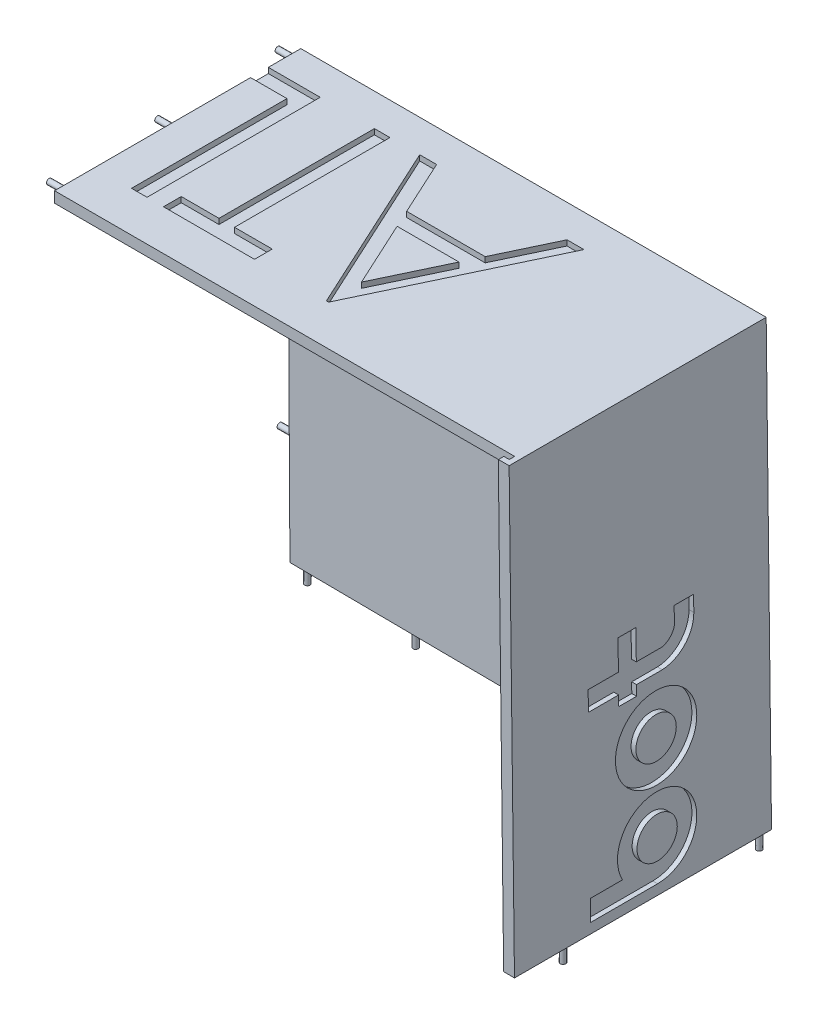
from build123d import *

# Parameters (mm, degrees)
SALIENTE_EXTRUIR1_DEPTH = 2.5
SALIENTE_EXTRUIR2_DEPTH = 45
CROQUIS17_R             = 2
CROQUIS17_R_2           = 1.5
CORTAR_EXTRUIR1_DEPTH   = 45
CROQUIS18_R             = 0.5
SALIENTE_EXTRUIR3_DEPTH = 3
CROQUIS19_W             = 84
CROQUIS19_H             = 2
CORTAR_EXTRUIR2_DEPTH   = 10
CROQUIS24_W             = 0.024080101
CROQUIS24_H             = 2
CORTAR_EXTRUIR11_DEPTH  = 2
CROQUIS30_W             = 1
CROQUIS30_H             = 1
CORTAR_EXTRUIR12_DEPTH  = 101
CROQUIS32_W             = 1
CROQUIS32_H             = 79.482316352
CORTAR_EXTRUIR13_DEPTH  = 1
CROQUIS33_W             = 1
CROQUIS33_H             = 1
CORTAR_EXTRUIR14_DEPTH  = 1
CROQUIS35_R             = 0.5
SALIENTE_EXTRUIR4_DEPTH = 3
CROQUIS37_R             = 0.5
CORTAR_EXTRUIR15_DEPTH  = 4
CROQUIS38_R             = 0.5
CORTAR_EXTRUIR16_DEPTH  = 4
CORTAR_EXTRUIR17_DEPTH  = 1
CROQUIS40_R             = 7.515901536
CROQUIS40_R_2           = 3.728280466
CROQUIS40_R_3           = 3.722695871
CORTAR_EXTRUIR19_DEPTH  = 0.9
CROQUIS41_R             = 0.5
SALIENTE_EXTRUIR5_DEPTH = 3
CROQUIS42_R             = 0.5
SALIENTE_EXTRUIR6_DEPTH = 3
CROQUIS45_R             = 0.5
CORTAR_EXTRUIR22_DEPTH  = 4
CROQUIS46_R             = 0.5
CORTAR_EXTRUIR23_DEPTH  = 4


with BuildPart() as part:
    # Croquis15 → Saliente-Extruir1 (new body)
    with BuildSketch(Plane.XY):
        Polygon((0, 80), (86, 80), (86.987170897, -1.494021214), (0.493585448, -0.747010607), align=None)
    extrude(amount=SALIENTE_EXTRUIR1_DEPTH)

    # Croquis16 → Saliente-Extruir2 (add)
    with BuildSketch(Plane.XY.offset(2.5)):
        Polygon((0, 80), (0.01204005, 78), (84.024080101, 78), (84.986811751, -1.476485582), (86.987170897, -1.494021214), (86, 80), align=None)
    extrude(amount=SALIENTE_EXTRUIR2_DEPTH)

    # Croquis17 → Cortar-Extruir1 (cut)
    with BuildSketch(Plane.XY.offset(2.5)):
        with Locations((79.072166937, 74)):
            Circle(CROQUIS17_R)
        with Locations((72.120400503, 63)):
            Circle(CROQUIS17_R_2)
    extrude(amount=-CORTAR_EXTRUIR1_DEPTH, mode=Mode.SUBTRACT)

    # Croquis18 → Saliente-Extruir3 (add)
    with BuildSketch(Plane(origin=(-0.006414337, -0.742692308, 0), x_dir=(0.9999627066458414, -0.008636279148040384, 0), z_dir=(-0.008636279148040384, -0.9999627066458414, 0))):
        with Locations(Location((2.500018433, 1.25, 0), (0, 0, 180))):
            Circle(CROQUIS18_R)
        with Locations(Location((85.996829638, 1.25, 0), (0, 0, 180))):
            Circle(CROQUIS18_R)
        with Locations(Location((22.500018433, 1.25, 0), (0, 0, 180))):
            Circle(CROQUIS18_R)
        with Locations(Location((65.996829638, 1.25, 0), (0, 0, 180))):
            Circle(CROQUIS18_R)
        with Locations(Location((43.496829638, 1.25, 0), (0, 0, 180))):
            Circle(CROQUIS18_R)
    extrude(amount=SALIENTE_EXTRUIR3_DEPTH)

    # Croquis19 → Cortar-Extruir2 (cut)
    with BuildSketch(Plane(origin=(0, 80, 0), x_dir=(1, 0, 0), z_dir=(0, 1, 0))):
        with Locations((42, -46.5)):
            Rectangle(CROQUIS19_W, CROQUIS19_H)
    extrude(amount=-CORTAR_EXTRUIR2_DEPTH, mode=Mode.SUBTRACT)

    # Croquis24 → Cortar-Extruir11 (cut)
    with BuildSketch(Plane.XY.offset(47.5)):
        with Locations((84.012040051, 79)):
            Rectangle(CROQUIS24_W, CROQUIS24_H)
    extrude(amount=-CORTAR_EXTRUIR11_DEPTH, mode=Mode.SUBTRACT)

    # Croquis30 → Cortar-Extruir12 (cut)
    with BuildSketch(Plane(origin=(0, 80, 0), x_dir=(1, 0, 0), z_dir=(0, 1, 0))):
        with Locations((84.524080101, -46)):
            Rectangle(CROQUIS30_W, CROQUIS30_H)
    extrude(amount=-CORTAR_EXTRUIR12_DEPTH, mode=Mode.SUBTRACT)

    # Croquis32 → Cortar-Extruir13 (cut)
    with BuildSketch(Plane(origin=(84.956460397, 1.029112859, 0), x_dir=(0, 0, 1), z_dir=(-0.9999266406620362, -0.01211252633991657, 0))):
        with Locations((46, 37.235375912)):
            Rectangle(CROQUIS32_W, CROQUIS32_H)
    extrude(amount=-CORTAR_EXTRUIR13_DEPTH, mode=Mode.SUBTRACT)

    # Croquis33 → Cortar-Extruir14 (cut)
    with BuildSketch(Plane(origin=(-0.006411756, -0.731414451, 0), x_dir=(0.9999615787185102, -0.008765904789859459, 0), z_dir=(-0.008765904789859457, -0.9999615787185101, 0))):
        with Locations((85.496489181, 46)):
            Rectangle(CROQUIS33_W, CROQUIS33_H)
    extrude(amount=-CORTAR_EXTRUIR14_DEPTH, mode=Mode.SUBTRACT)

    # Croquis35 → Saliente-Extruir4 (add)
    with BuildSketch(Plane(origin=(-0.006411756, -0.731414451, 0), x_dir=(0.9999615787185102, -0.008765904789859459, 0), z_dir=(-0.008765904789859457, -0.9999615787185101, 0))):
        with Locations(Location((85.996707183, 37.5, 0), (0, 0, 180))):
            Circle(CROQUIS35_R)
    extrude(amount=SALIENTE_EXTRUIR4_DEPTH)

    # Croquis37 → Cortar-Extruir15 (cut)
    with BuildSketch(Plane(origin=(-0.006411756, -0.731414451, 0), x_dir=(0.9999615787185102, -0.008765904789859459, 0), z_dir=(-0.008765904789859457, -0.9999615787185101, 0))):
        with Locations((85.996925186, 9.5)):
            Circle(CROQUIS37_R)
    extrude(amount=-CORTAR_EXTRUIR15_DEPTH, mode=Mode.SUBTRACT)

    # Croquis38 → Cortar-Extruir16 (cut)
    with BuildSketch(Plane(origin=(-0.006414337, -0.742692308, 0), x_dir=(0.9999627066458414, -0.008636279148040382, 0), z_dir=(-0.008636279148040382, -0.9999627066458414, 0))):
        with Locations((12.500018433, 1.25)):
            Circle(CROQUIS38_R)
        with Locations((32.500018433, 1.25)):
            Circle(CROQUIS38_R)
        with Locations((55.000018433, 1.25)):
            Circle(CROQUIS38_R)
        with Locations((77.000018433, 1.25)):
            Circle(CROQUIS38_R)
    extrude(amount=-CORTAR_EXTRUIR16_DEPTH, mode=Mode.SUBTRACT)

    # Croquis39 → Cortar-Extruir17 (cut)
    # profile 1 of 3: a face of its own
    with BuildSketch(Plane(origin=(0, 80, 0), x_dir=(1, 0, 0), z_dir=(0, 1, 0))):
        Polygon((42.740086015, -38), (27.970855246, -6), (31.092650117, -6), (35.823419348, -16.256410256), (50.329829605, -16.256410256), (55.19521422, -6), (58.329829605, -6), (43.150342425, -38), align=None)
        Polygon((42.977265502, -31.762820513), (48.772137297, -19.538461538), (37.336239861, -19.538461538), align=None, mode=Mode.SUBTRACT)
    # profile 2 of 3: a face of its own
    with BuildSketch(Plane(origin=(0, 80, 0), x_dir=(1, 0, 0), z_dir=(0, 1, 0))):
        Polygon((29.447778323, -34.717948718), (29.447778323, -38), (12.627265502, -38), (12.627265502, -34.717948718), (19.601624476, -34.717948718), (19.601624476, -6), (22.473419348, -6), (22.473419348, -34.717948718), align=None)
    # profile 3 of 3: a face of its own
    with BuildSketch(Plane(origin=(0, 80, 0), x_dir=(1, 0, 0), z_dir=(0, 1, 0))):
        Polygon((9.591368066, -38), (6.719573194, -38), (6.719573194, -9.282051282), (-5.588119113, -9.282051282), (-5.588119113, -6), (9.591368066, -6), align=None)
    extrude(amount=-CORTAR_EXTRUIR17_DEPTH, mode=Mode.SUBTRACT)

    # Croquis40 → Cortar-Extruir19 (cut)
    # profile 1 of 3: a face of its own
    with BuildSketch(Plane(origin=(86.956313679, 1.053337912, 0), x_dir=(0, 0, -1), z_dir=(0.9999266406620362, 0.012112526339916658, 0))):
        with Locations(Location((-21.026467212, 22.472656931, 0), (0, 0, 90))):
            Circle(CROQUIS40_R)
        with Locations(Location((-21.026467212, 22.472656931, 0), (0, 0, 90))):
            Circle(CROQUIS40_R_2, mode=Mode.SUBTRACT)
    # profile 2 of 3: a face of its own
    with BuildSketch(Plane(origin=(86.956313679, 1.053337912, 0), x_dir=(0, 0, -1), z_dir=(0.9999266406620362, 0.012112526339916658, 0))):
        with BuildLine():
            Line((-21.026467212, -0.713555766), (-33.411935882, -0.713555766))
            Line((-33.411935882, -0.713555766), (-33.411935882, 3.110384386))
            Line((-33.411935882, 3.110384386), (-27.461333641, 3.110384386))
            ThreePointArc((-27.461333641, 3.110384386), (-17.28380692, 12.910750348), (-21.026467212, -0.713555766))
        make_face()
        with Locations(Location((-21.026467212, 6.612660391, 0), (0, 0, 90))):
            Circle(CROQUIS40_R_3, mode=Mode.SUBTRACT)
    # profile 3 of 3: a face of its own
    with BuildSketch(Plane(origin=(86.956313679, 1.053337912, 0), x_dir=(0, 0, -1), z_dir=(0.9999266406620362, 0.012112526339916658, 0))):
        with BuildLine():
            Line((-24.518011858, 36.31920775), (-24.518011858, 41.791750463))
            Line((-24.518011858, 41.791750463), (-27.82511635, 41.791750463))
            Line((-27.82511635, 41.791750463), (-27.82511635, 36.31920775))
            Line((-27.82511635, 36.31920775), (-33.411935882, 36.31920775))
            Line((-33.411935882, 36.31920775), (-33.411935882, 32.706016439))
            Line((-33.411935882, 32.706016439), (-27.82511635, 32.706016439))
            Line((-27.82511635, 32.706016439), (-27.82511635, 30.846665037))
            Line((-27.82511635, 30.846665037), (-24.518011858, 30.846665037))
            Line((-24.518011858, 30.846665037), (-24.518011858, 32.706016439))
            Line((-24.518011858, 32.706016439), (-19.754047189, 32.706016439))
            ThreePointArc((-19.754047189, 32.706016439), (-15.568413472, 34.624986495), (-13.859170054, 38.900552261))
            Line((-13.859170054, 38.900552261), (-13.859170054, 41.791750463))
            Line((-13.859170054, 41.791750463), (-17.451500124, 41.791750463))
            Line((-17.451500124, 41.791750463), (-17.451500124, 38.573932348))
            ThreePointArc((-17.451500124, 38.573932348), (-18.28309704, 37.120113126), (-19.754047189, 36.31920775))
            Line((-19.754047189, 36.31920775), (-24.518011858, 36.31920775))
        make_face()
    extrude(amount=-CORTAR_EXTRUIR19_DEPTH, mode=Mode.SUBTRACT)

    # Croquis41 → Saliente-Extruir5 (add)
    with BuildSketch(Plane(origin=(0.489000895, 0.002989135, 0), x_dir=(0, 0, 1), z_dir=(-0.9999813177309185, -0.006112625388175003, 0))):
        with Locations(Location((1.25, 78.998505418, 0), (0, 0, 90))):
            Circle(CROQUIS41_R)
        with Locations(Location((1.25, 58.998505418, 0), (0, 0, 90))):
            Circle(CROQUIS41_R)
        with Locations(Location((1.25, 38.998505418, 0), (0, 0, 90))):
            Circle(CROQUIS41_R)
        with Locations(Location((1.25, 18.998505418, 0), (0, 0, 90))):
            Circle(CROQUIS41_R)
    extrude(amount=SALIENTE_EXTRUIR5_DEPTH)

    # Croquis42 → Saliente-Extruir6 (add)
    with BuildSketch(Plane(origin=(0.481584557, 0.002899151, 0), x_dir=(0, 0, 1), z_dir=(-0.9999818801412468, -0.006019916044037572, 0))):
        with Locations(Location((43.5, 78.998532291, 0), (0, 0, 90))):
            Circle(CROQUIS42_R)
        with Locations(Location((23.5, 78.998532291, 0), (0, 0, 90))):
            Circle(CROQUIS42_R)
    extrude(amount=SALIENTE_EXTRUIR6_DEPTH)

    # Croquis45 → Cortar-Extruir22 (cut)
    with BuildSketch(Plane(origin=(0.481584557, 0.002899151, 0), x_dir=(0, 0, 1), z_dir=(-0.9999818801412468, -0.006019916044037572, 0))):
        with Locations(Location((33.5, 78.998532291, 0), (0, 0, 270))):
            Circle(CROQUIS45_R)
        with Locations(Location((13.5, 78.998532291, 0), (0, 0, 270))):
            Circle(CROQUIS45_R)
    extrude(amount=-CORTAR_EXTRUIR22_DEPTH, mode=Mode.SUBTRACT)

    # Croquis46 → Cortar-Extruir23 (cut)
    with BuildSketch(Plane(origin=(0.489000895, 0.002989135, 0), x_dir=(0, 0, 1), z_dir=(-0.9999813177309185, -0.006112625388175003, 0))):
        with Locations(Location((1.25, 68.998505418, 0), (0, 0, 270))):
            Circle(CROQUIS46_R)
        with Locations(Location((1.25, 48.998505418, 0), (0, 0, 270))):
            Circle(CROQUIS46_R)
        with Locations(Location((1.25, 28.998505418, 0), (0, 0, 270))):
            Circle(CROQUIS46_R)
        with Locations(Location((1.25, 8.998505418, 0), (0, 0, 270))):
            Circle(CROQUIS46_R)
    extrude(amount=-CORTAR_EXTRUIR23_DEPTH, mode=Mode.SUBTRACT)


solid = part.part
